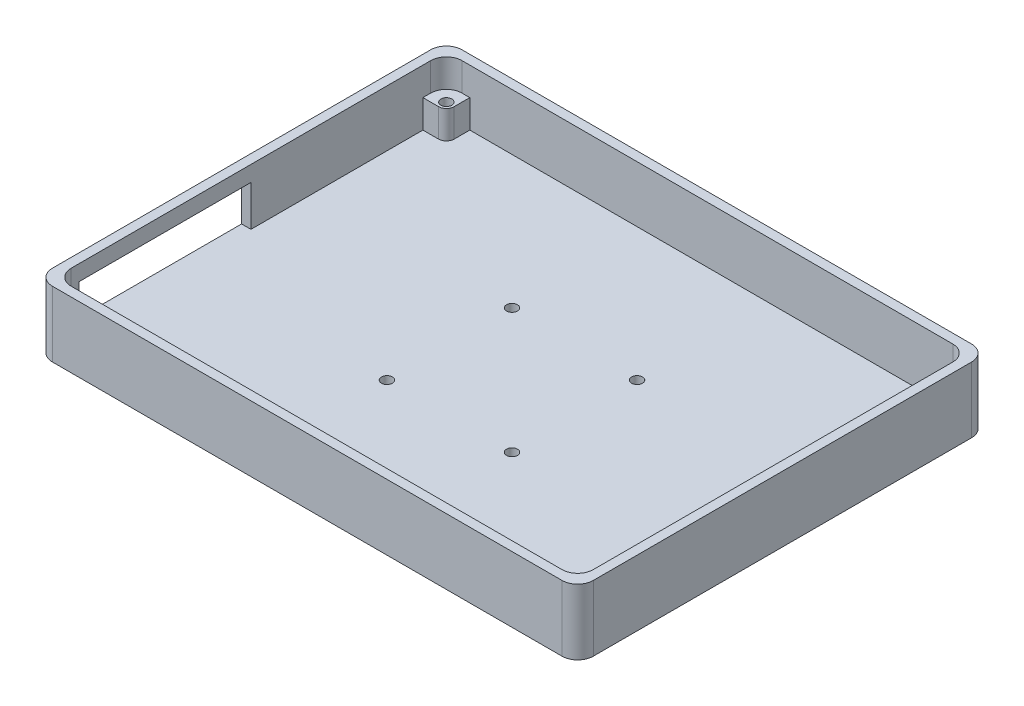
from build123d import *
from build123d.topology import SkipClean

# Parameters (mm, degrees)
SKETCH_1_W          = 173
SKETCH_1_H          = 131
EXTRUDE_1_DEPTH     = 3
SKETCH_1_3_W        = 3
SKETCH_1_3_H        = 3
EXTRUDE_2_DEPTH     = 21
EXTRUDE_3_DEPTH     = 12
SKETCH_3_W          = 55
SKETCH_3_H          = 13
CUT_EXTRUDE_1_DEPTH = 4
CUT_EXTRUDE_START   = -14
SKETCH_4_R          = 1.75
CUT_EXTRUDE_2_DEPTH = 14
CUT_EXTRUDE_3_DEPTH = 4
FILLET_1_R          = 5
FILLET_2_R          = 5


with BuildPart() as part:
    # 草图1 → 凸台-拉伸1 (new body)
    with BuildSketch(Plane(origin=(0, 0, 0), x_dir=(1, 0, 0), z_dir=(0, 1, 0))):
        with Locations((0, -57.5)):
            Rectangle(SKETCH_1_W, SKETCH_1_H)
    extrude(amount=EXTRUDE_1_DEPTH)

    # 草图1<3> → 凸台-拉伸2 (add)
    # profile 1 of 2: a face of its own
    with BuildSketch(Plane(origin=(0, 0, 0), x_dir=(1, 0, 0), z_dir=(0, 1, 0))):
        Polygon((-86.5, -120), (-83.5, -120), (-83.5, -123), (83.5, -123), (86.5, -123), (86.5, 8), (-86.5, 8), align=None)
        Polygon((-76, 5), (76, 5), (78.5, 5), (83.5, 5), (83.5, -2.5), (83.5, -112.5), (83.5, -115), (83.5, -120), (76, -120), (-76, -120), (-83.5, -120), (-83.5, -112.5), (-83.5, -2.5), (-83.5, 5), (-78.5, 5), align=None, mode=Mode.SUBTRACT)
    # profile 2 of 2: a face of its own
    with BuildSketch(Plane(origin=(0, 0, 0), x_dir=(1, 0, 0), z_dir=(0, 1, 0))):
        with Locations((-85, -121.5)):
            Rectangle(SKETCH_1_3_W, SKETCH_1_3_H)
    extrude(amount=EXTRUDE_2_DEPTH)

    # 草图1<5> → 凸台-拉伸3 (add)
    with BuildSketch(Plane(origin=(0, 0, 0), x_dir=(1, 0, 0), z_dir=(0, 1, 0))):
        with BuildLine():
            ThreePointArc((81, -115), (80.267766953, -113.232233047), (78.5, -112.5))
            Line((78.5, -112.5), (78.5, -113.25))
            ThreePointArc((78.5, -113.25), (79.737436867, -113.762563133), (80.25, -115))
            ThreePointArc((80.25, -115), (78.5, -116.75), (76.75, -115))
            Line((76.75, -115), (76, -115))
            ThreePointArc((76, -115), (78.5, -117.5), (81, -115))
        make_face()
        with BuildLine():
            Line((78.5, -113.25), (78.5, -112.5))
            ThreePointArc((78.5, -112.5), (76.732233047, -113.232233047), (76, -115))
            Line((76, -115), (76.75, -115))
            ThreePointArc((76.75, -115), (77.262563133, -113.762563133), (78.5, -113.25))
        make_face()
        with BuildLine():
            ThreePointArc((-76, -115), (-76.732233047, -113.232233047), (-78.5, -112.5))
            Line((-78.5, -112.5), (-78.5, -113.25))
            ThreePointArc((-78.5, -113.25), (-77.262563133, -113.762563133), (-76.75, -115))
            Line((-76.75, -115), (-76, -115))
        make_face()
        with BuildLine():
            Line((-78.5, -113.25), (-78.5, -112.5))
            ThreePointArc((-78.5, -112.5), (-80.267766953, -116.767766953), (-76, -115))
            Line((-76, -115), (-76.75, -115))
            ThreePointArc((-76.75, -115), (-79.737436867, -116.237436867), (-78.5, -113.25))
        make_face()
        with BuildLine():
            Line((-76.75, 0), (-76, 0))
            ThreePointArc((-76, 0), (-76.732233047, 1.767766953), (-78.5, 2.5))
            Line((-78.5, 2.5), (-78.5, 1.75))
            ThreePointArc((-78.5, 1.75), (-77.262563133, 1.237436867), (-76.75, 0))
        make_face()
        with BuildLine():
            ThreePointArc((-78.5, 2.5), (-81, 0), (-78.5, -2.5))
            Line((-78.5, -2.5), (-78.5, -1.75))
            ThreePointArc((-78.5, -1.75), (-80.25, 0), (-78.5, 1.75))
            Line((-78.5, 1.75), (-78.5, 2.5))
        make_face()
        with BuildLine():
            ThreePointArc((-78.5, -2.5), (-76.732233047, -1.767766953), (-76, 0))
            Line((-76, 0), (-76.75, 0))
            ThreePointArc((-76.75, 0), (-77.262563133, -1.237436867), (-78.5, -1.75))
            Line((-78.5, -1.75), (-78.5, -2.5))
        make_face()
        with BuildLine():
            ThreePointArc((81, 0), (78.5, 2.5), (76, 0))
            Line((76, 0), (76.75, 0))
            ThreePointArc((76.75, 0), (78.5, 1.75), (80.25, 0))
            ThreePointArc((80.25, 0), (79.737436867, -1.237436867), (78.5, -1.75))
            Line((78.5, -1.75), (78.5, -2.5))
            ThreePointArc((78.5, -2.5), (80.267766953, -1.767766953), (81, 0))
        make_face()
        with BuildLine():
            Line((76.75, 0), (76, 0))
            ThreePointArc((76, 0), (76.732233047, -1.767766953), (78.5, -2.5))
            Line((78.5, -2.5), (78.5, -1.75))
            ThreePointArc((78.5, -1.75), (77.262563133, -1.237436867), (76.75, 0))
        make_face()
        with BuildLine():
            Line((-83.5, -2.5), (-78.5, -2.5))
            ThreePointArc((-78.5, -2.5), (-81, 0), (-78.5, 2.5))
            Line((-78.5, 2.5), (-78.5, 5))
            Line((-78.5, 5), (-83.5, 5))
            Line((-83.5, 5), (-83.5, -2.5))
        make_face()
        with BuildLine():
            ThreePointArc((-78.5, 2.5), (-76.732233047, 1.767766953), (-76, 0))
            Line((-76, 0), (-76, 5))
            Line((-76, 5), (-78.5, 5))
            Line((-78.5, 5), (-78.5, 2.5))
        make_face()
        with BuildLine():
            Line((76, 5), (76, 0))
            ThreePointArc((76, 0), (78.5, 2.5), (81, 0))
            ThreePointArc((81, 0), (80.267766953, -1.767766953), (78.5, -2.5))
            Line((78.5, -2.5), (83.5, -2.5))
            Line((83.5, -2.5), (83.5, 5))
            Line((83.5, 5), (78.5, 5))
            Line((78.5, 5), (76, 5))
        make_face()
        with BuildLine():
            Line((83.5, -112.5), (78.5, -112.5))
            ThreePointArc((78.5, -112.5), (80.267766953, -113.232233047), (81, -115))
            ThreePointArc((81, -115), (78.5, -117.5), (76, -115))
            Line((76, -115), (76, -120))
            Line((76, -120), (83.5, -120))
            Line((83.5, -120), (83.5, -115))
            Line((83.5, -115), (83.5, -112.5))
        make_face()
        with BuildLine():
            ThreePointArc((-76, -115), (-80.267766953, -116.767766953), (-78.5, -112.5))
            Line((-78.5, -112.5), (-83.5, -112.5))
            Line((-83.5, -112.5), (-83.5, -120))
            Line((-83.5, -120), (-76, -120))
            Line((-76, -120), (-76, -115))
        make_face()
    extrude(amount=EXTRUDE_3_DEPTH)

    # 草图3 → 切除-拉伸1 (cut)
    with BuildSketch(Plane.ZY.offset(86.5)):
        with Locations((85, 9.5)):
            Rectangle(SKETCH_3_W, SKETCH_3_H)
    extrude(amount=-CUT_EXTRUDE_1_DEPTH, mode=Mode.SUBTRACT)

    # 草图4 → 切除-拉伸2 (cut)
    with SkipClean():  # the faces are left unmerged after this step: merging them gives an invalid solid
        with BuildSketch(Plane(origin=(0, 12, 0), x_dir=(1, 0, 0), z_dir=(0, 1, 0)).offset(CUT_EXTRUDE_START)):
            with Locations(Location((-78.5, 0, 0), (0, 0, 270))):
                Circle(SKETCH_4_R)
            with Locations(Location((78.5, 0, 0), (0, 0, 270))):
                Circle(SKETCH_4_R)
            with Locations(Location((78.5, -115, 0), (0, 0, 270))):
                Circle(SKETCH_4_R)
            with Locations(Location((-78.5, -115, 0), (0, 0, 270))):
                Circle(SKETCH_4_R)
        extrude(amount=CUT_EXTRUDE_2_DEPTH, mode=Mode.SUBTRACT)

    # 草图5 → 切除-拉伸3 (cut)
    with SkipClean():  # the faces are left unmerged after this step: merging them gives an invalid solid
        with BuildSketch(Plane(origin=(0, 3, 0), x_dir=(1, 0, 0), z_dir=(0, 1, 0))):
            with BuildLine():
                ThreePointArc((18.25, -37.5), (18.762563133, -38.737436867), (20, -39.25))
                Line((20, -39.25), (20, -37.5))
                Line((20, -37.5), (18.25, -37.5))
            make_face()
            with BuildLine():
                Line((20, -37.5), (20, -39.25))
                ThreePointArc((20, -39.25), (21.237436867, -38.737436867), (21.75, -37.5))
                ThreePointArc((21.75, -37.5), (20, -35.75), (18.25, -37.5))
                Line((18.25, -37.5), (20, -37.5))
            make_face()
            with BuildLine():
                ThreePointArc((21.75, -77.5), (21.237436867, -76.262563133), (20, -75.75))
                Line((20, -75.75), (20, -77.5))
                Line((20, -77.5), (18.25, -77.5))
                ThreePointArc((18.25, -77.5), (20, -79.25), (21.75, -77.5))
            make_face()
            with BuildLine():
                Line((20, -77.5), (20, -75.75))
                ThreePointArc((20, -75.75), (18.762563133, -76.262563133), (18.25, -77.5))
                Line((18.25, -77.5), (20, -77.5))
            make_face()
            with BuildLine():
                ThreePointArc((-18.25, -77.5), (-18.762563133, -76.262563133), (-20, -75.75))
                Line((-20, -75.75), (-20, -77.5))
                Line((-20, -77.5), (-18.25, -77.5))
            make_face()
            with BuildLine():
                Line((-20, -77.5), (-20, -75.75))
                ThreePointArc((-20, -75.75), (-21.237436867, -78.737436867), (-18.25, -77.5))
                Line((-18.25, -77.5), (-20, -77.5))
            make_face()
            with BuildLine():
                ThreePointArc((-18.25, -37.5), (-21.237436867, -36.262563133), (-20, -39.25))
                Line((-20, -39.25), (-20, -37.5))
                Line((-20, -37.5), (-18.25, -37.5))
            make_face()
            with BuildLine():
                Line((-20, -37.5), (-20, -39.25))
                ThreePointArc((-20, -39.25), (-18.762563133, -38.737436867), (-18.25, -37.5))
                Line((-18.25, -37.5), (-20, -37.5))
            make_face()
        extrude(amount=-CUT_EXTRUDE_3_DEPTH, mode=Mode.SUBTRACT)

    # 圆角1
    fillet_1_edges = [part.edges().sort_by_distance(p)[0] for p in [
        (-86.5, 10.5, 123),
        (-86.5, 10.5, -8),
        (86.5, 10.5, -8),
        (86.5, 10.5, 123),
    ]]
    fillet(fillet_1_edges, radius=FILLET_1_R)

    # 圆角2
    fillet_2_edges = [part.edges().sort_by_distance(p)[0] for p in [
        (83.5, 16.5, 120),
        (-83.5, 16.5, 120),
        (-83.5, 16.5, -5),
        (83.5, 16.5, -5),
    ]]
    fillet(fillet_2_edges, radius=FILLET_2_R)


solid = part.part
